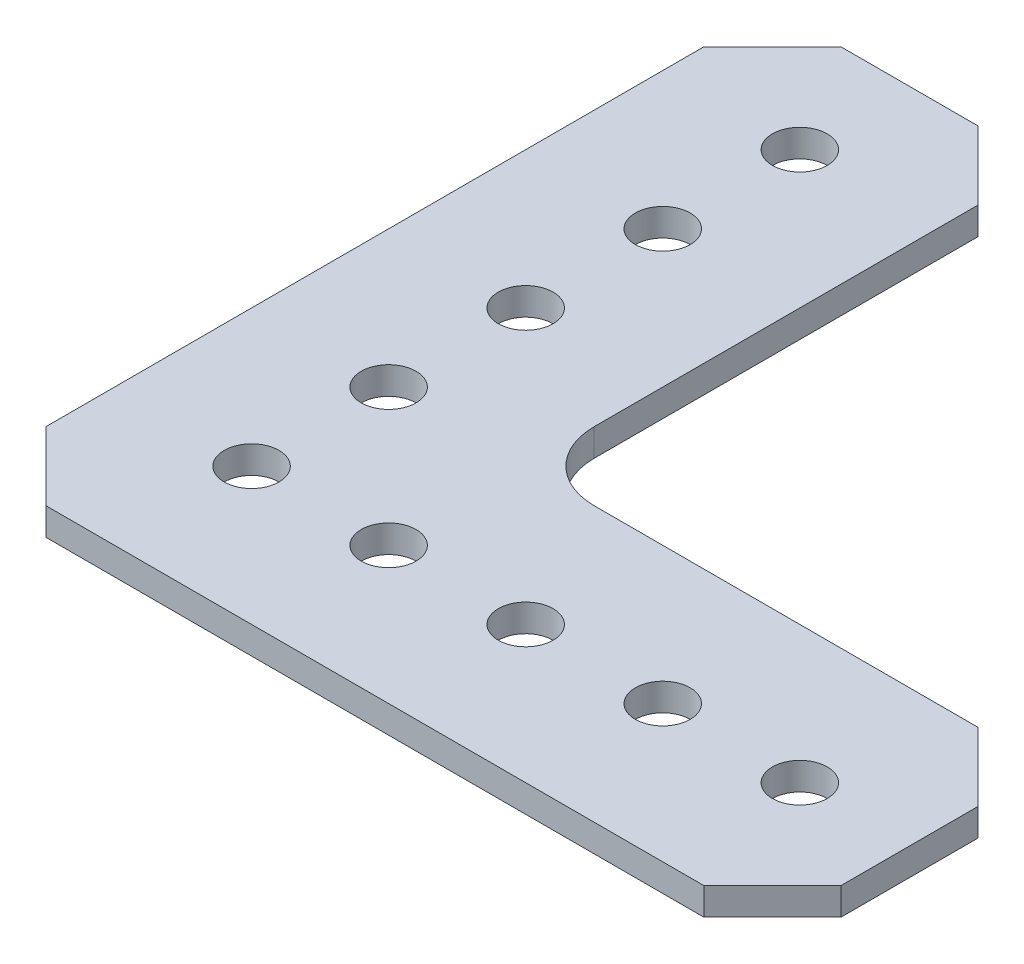
from build123d import *

# Parameters (mm, degrees)
EXTRUDE_1_DEPTH       = 2
HOLE_WIZARD_4_0_4_1_D = 4
HOLE_WIZARD_4_0_4_2_D = 4
FILLET_1_R            = 5
CHAMFER_4_SIZE        = 5


with BuildPart() as part:
    # 草圖1 → 填料-伸長1 (new body)
    with BuildSketch(Plane(origin=(0, 0, 0), x_dir=(1, 0, 0), z_dir=(0, 1, 0))):
        Polygon((-10, 0), (10, 0), (10, -38), (48, -38), (48, -58), (-10, -58), align=None)
    extrude(amount=EXTRUDE_1_DEPTH)

    # Ø4.0 (4) 直徑孔1 (through all)
    with Locations(Plane(origin=(0, 0, 0), x_dir=(-1, 0, 0), z_dir=(0, -1, 0))):
        with Locations((0, -28), (0, -48), (-20, -48), (-40, -48), (0, -8)):
            Hole(HOLE_WIZARD_4_0_4_1_D / 2)

    # Ø4.0 (4) 直徑孔2 (through all)
    with Locations(Plane(origin=(0, 0, 0), x_dir=(-1, 0, 0), z_dir=(0, -1, 0))):
        with Locations((0, -18), (-10, -48), (0, -38), (-30, -48)):
            Hole(HOLE_WIZARD_4_0_4_2_D / 2)

    # 圓角1
    fillet_1_edges = [part.edges().sort_by_distance(p)[0] for p in [
        (10, 1, 38),
    ]]
    fillet(fillet_1_edges, radius=FILLET_1_R)

    # 導角4
    chamfer_4_edges = [part.edges().sort_by_distance(p)[0] for p in [
        (-10, 1, 58),
        (-10, 1, 0),
        (10, 1, 0),
        (48, 1, 38),
        (48, 1, 58),
    ]]
    chamfer(chamfer_4_edges, length=CHAMFER_4_SIZE)


solid = part.part
